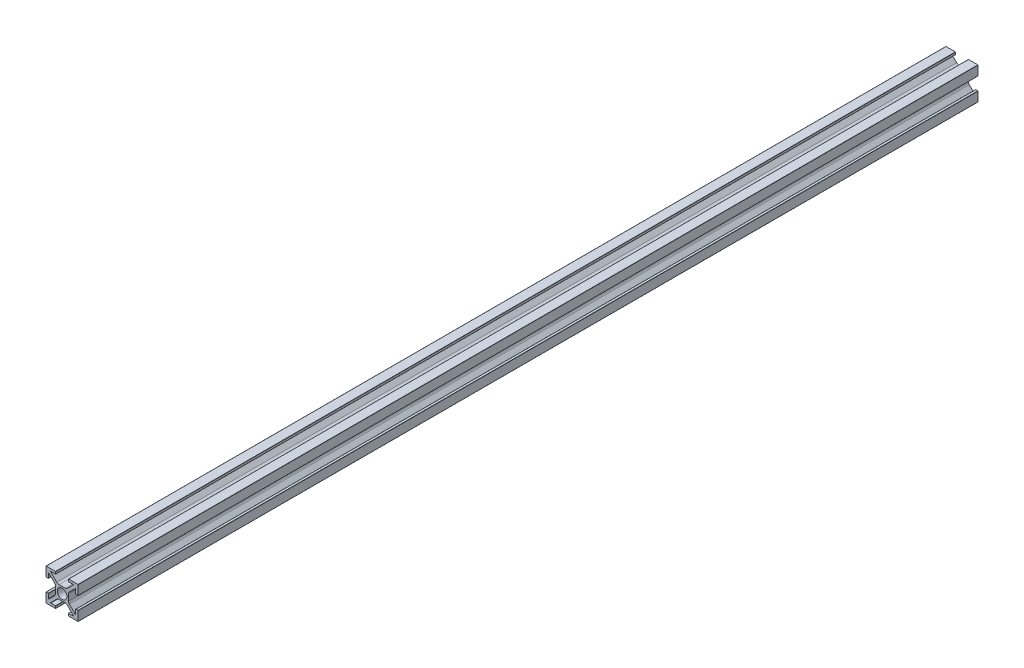
from build123d import *

# Parameters (mm, degrees)
SKETCH1_R           = 3
BOSS_EXTRUDE2_DEPTH = 560


with BuildPart() as part:
    # Sketch1 → Boss-Extrude2 (new body)
    with BuildSketch(Plane.XY.offset(60)):
        with BuildLine():
            Line((18.5, 17.008578644), (18.5, 14.1))
            ThreePointArc((18.5, 14.1), (18.529289322, 14.029289322), (18.6, 14))
            Line((18.6, 14), (19.9, 14))
            ThreePointArc((19.9, 14), (19.970710678, 14.029289322), (20, 14.1))
            Line((20, 14.1), (20, 19.9))
            ThreePointArc((20, 19.9), (19.970710678, 19.970710678), (19.9, 20))
            Line((19.9, 20), (14.1, 20))
            ThreePointArc((14.1, 20), (14.029289322, 19.970710678), (14, 19.9))
            Line((14, 19.9), (14, 18.6))
            ThreePointArc((14, 18.6), (14.029289322, 18.529289322), (14.1, 18.5))
            Line((14.1, 18.5), (17.008578644, 18.5))
            ThreePointArc((17.008578644, 18.5), (17.100966597, 18.438268343), (17.079289322, 18.329289322))
            Line((17.079289322, 18.329289322), (13.335786438, 14.585786438))
            ThreePointArc((13.335786438, 14.585786438), (12.68693974, 14.152240935), (11.921572875, 14))
            Line((11.921572875, 14), (8.078427125, 14))
            ThreePointArc((8.078427125, 14), (7.31306026, 14.152240935), (6.664213562, 14.585786438))
            Line((6.664213562, 14.585786438), (2.920710678, 18.329289322))
            ThreePointArc((2.920710678, 18.329289322), (2.899033403, 18.438268343), (2.991421356, 18.5))
            Line((2.991421356, 18.5), (5.9, 18.5))
            ThreePointArc((5.9, 18.5), (5.970710678, 18.529289322), (6, 18.6))
            Line((6, 18.6), (6, 19.9))
            ThreePointArc((6, 19.9), (5.970710678, 19.970710678), (5.9, 20))
            Line((5.9, 20), (0.1, 20))
            ThreePointArc((0.1, 20), (0.029289322, 19.970710678), (0, 19.9))
            Line((0, 19.9), (0, 14.1))
            ThreePointArc((0, 14.1), (0.029289322, 14.029289322), (0.1, 14))
            Line((0.1, 14), (1.4, 14))
            ThreePointArc((1.4, 14), (1.470710678, 14.029289322), (1.5, 14.1))
            Line((1.5, 14.1), (1.5, 17.008578644))
            ThreePointArc((1.5, 17.008578644), (1.561731657, 17.100966597), (1.670710678, 17.079289322))
            Line((1.670710678, 17.079289322), (5.414213562, 13.335786438))
            ThreePointArc((5.414213562, 13.335786438), (5.847759065, 12.68693974), (6, 11.921572875))
            Line((6, 11.921572875), (6, 8.078427125))
            ThreePointArc((6, 8.078427125), (5.847759065, 7.31306026), (5.414213562, 6.664213562))
            Line((5.414213562, 6.664213562), (1.670710678, 2.920710678))
            ThreePointArc((1.670710678, 2.920710678), (1.561731657, 2.899033403), (1.5, 2.991421356))
            Line((1.5, 2.991421356), (1.5, 5.9))
            ThreePointArc((1.5, 5.9), (1.470710678, 5.970710678), (1.4, 6))
            Line((1.4, 6), (0.1, 6))
            ThreePointArc((0.1, 6), (0.029289322, 5.970710678), (0, 5.9))
            Line((0, 5.9), (0, 0.1))
            ThreePointArc((0, 0.1), (0.029289322, 0.029289322), (0.1, 0))
            Line((0.1, 0), (5.9, 0))
            ThreePointArc((5.9, 0), (5.970710678, 0.029289322), (6, 0.1))
            Line((6, 0.1), (6, 1.4))
            ThreePointArc((6, 1.4), (5.970710678, 1.470710678), (5.9, 1.5))
            Line((5.9, 1.5), (2.991421356, 1.5))
            ThreePointArc((2.991421356, 1.5), (2.899033403, 1.561731657), (2.920710678, 1.670710678))
            Line((2.920710678, 1.670710678), (6.664213562, 5.414213562))
            ThreePointArc((6.664213562, 5.414213562), (7.31306026, 5.847759065), (8.078427125, 6))
            Line((8.078427125, 6), (11.921572875, 6))
            ThreePointArc((11.921572875, 6), (12.68693974, 5.847759065), (13.335786438, 5.414213562))
            Line((13.335786438, 5.414213562), (17.079289322, 1.670710678))
            ThreePointArc((17.079289322, 1.670710678), (17.100966597, 1.561731657), (17.008578644, 1.5))
            Line((17.008578644, 1.5), (14.1, 1.5))
            ThreePointArc((14.1, 1.5), (14.029289322, 1.470710678), (14, 1.4))
            Line((14, 1.4), (14, 0.1))
            ThreePointArc((14, 0.1), (14.029289322, 0.029289322), (14.1, 0))
            Line((14.1, 0), (19.9, 0))
            ThreePointArc((19.9, 0), (19.970710678, 0.029289322), (20, 0.1))
            Line((20, 0.1), (20, 5.9))
            ThreePointArc((20, 5.9), (19.970710678, 5.970710678), (19.9, 6))
            Line((19.9, 6), (18.6, 6))
            ThreePointArc((18.6, 6), (18.529289322, 5.970710678), (18.5, 5.9))
            Line((18.5, 5.9), (18.5, 2.991421356))
            ThreePointArc((18.5, 2.991421356), (18.438268343, 2.899033403), (18.329289322, 2.920710678))
            Line((18.329289322, 2.920710678), (14.585786438, 6.664213562))
            ThreePointArc((14.585786438, 6.664213562), (14.152240935, 7.31306026), (14, 8.078427125))
            Line((14, 8.078427125), (14, 11.921572875))
            ThreePointArc((14, 11.921572875), (14.152240935, 12.68693974), (14.585786438, 13.335786438))
            Line((14.585786438, 13.335786438), (18.329289322, 17.079289322))
            ThreePointArc((18.329289322, 17.079289322), (18.438268343, 17.100966597), (18.5, 17.008578644))
        make_face()
        with Locations(Location((10, 10, 0), (0, 0, 180))):
            Circle(SKETCH1_R, mode=Mode.SUBTRACT)
    extrude(amount=BOSS_EXTRUDE2_DEPTH)


solid = part.part
